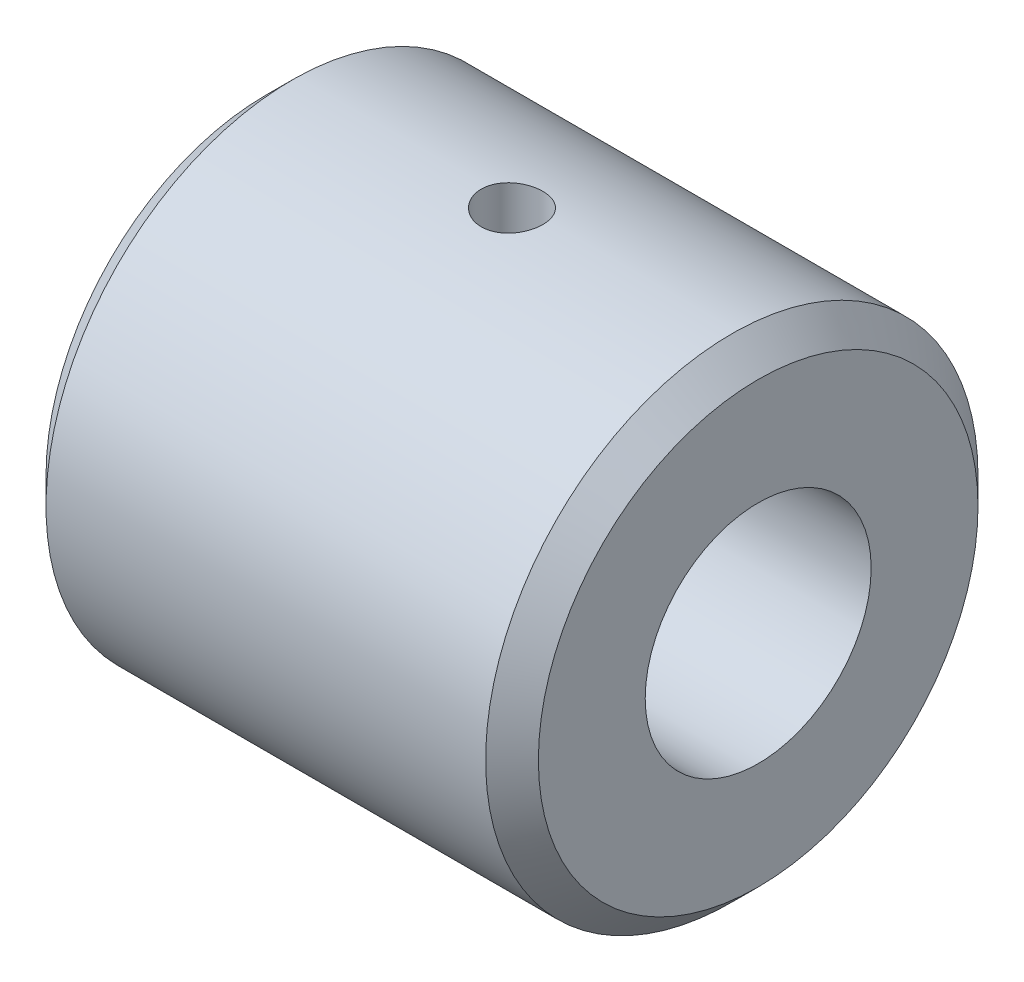
from build123d import *

# Parameters (mm, degrees)
SKETCH1_R                    = 3.556
BOSS_EXTRUDE1_DEPTH          = 3.556
F_30_0_1285_DIAMETER_HOLE1_D = 3.2639
CHAMFER2_SIZE                = 0.381
F_65_0_035_DIAMETER_HOLE2_D  = 0.889


with BuildPart() as part:
    # Sketch1 → Boss-Extrude1 (new, symmetric)
    with BuildSketch(Plane(origin=(0, 0, 0), x_dir=(0, 0, -1), z_dir=(1, 0, 0))):
        Circle(SKETCH1_R)
    extrude(amount=BOSS_EXTRUDE1_DEPTH, both=True)

    # #30 (0.1285) Diameter Hole1 (through all)
    with Locations(Plane(origin=(3.556, 0, 0), x_dir=(0, 0, -1), z_dir=(1, 0, 0))):
        with Locations((0, 0)):
            Hole(F_30_0_1285_DIAMETER_HOLE1_D / 2)

    # Chamfer2
    chamfer2_edges = [part.edges().sort_by_distance(p)[0] for p in [
        (-3.556, 0, 3.556),
        (3.556, 0, 3.556),
    ]]
    chamfer(chamfer2_edges, length=CHAMFER2_SIZE)

    # #65 (0.035) Diameter Hole2 (through all)
    with Locations(Plane(origin=(0, 3.556, 0), x_dir=(1, 0, 0), z_dir=(0, 1, 0))):
        with Locations((0, 0)):
            Hole(F_65_0_035_DIAMETER_HOLE2_D / 2)


solid = part.part
